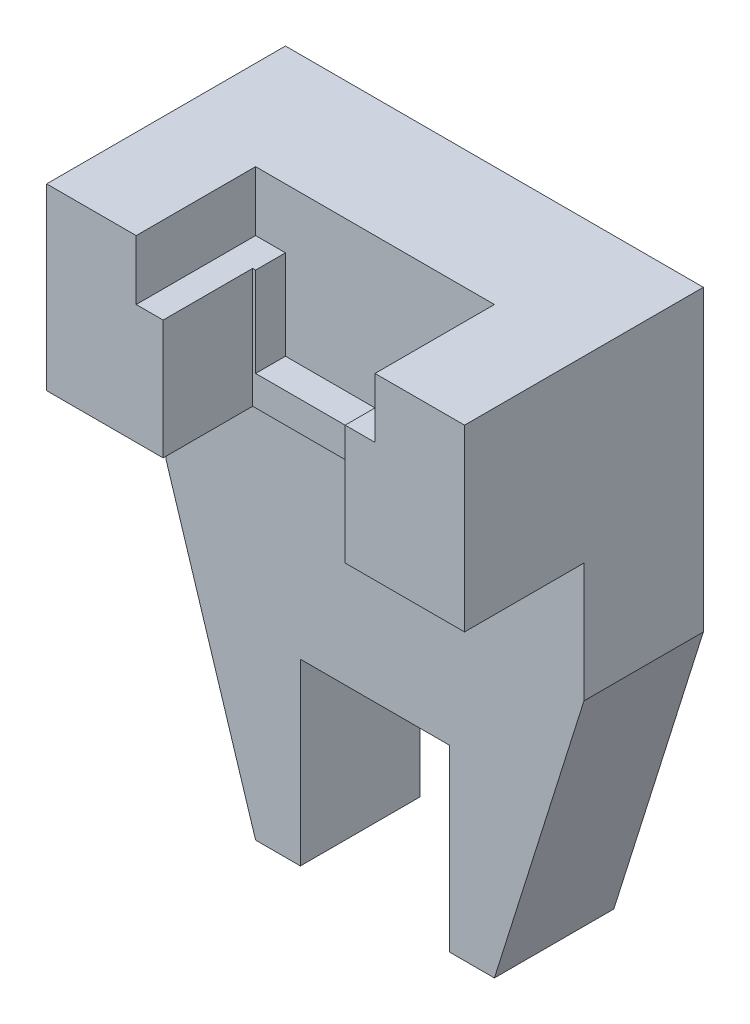
from build123d import *

# Parameters (mm, degrees)
BOSS_EXTRUDE1_DEPTH = 20
SKETCH2_W           = 15
SKETCH2_H           = 10
BOSS_EXTRUDE3_DEPTH = 40
BOSS_EXTRUDE5_DEPTH = 40
SKETCH6_W           = 30
SKETCH6_H           = 15
CUT_EXTRUDE2_DEPTH  = 40
SKETCH8_W           = 0.49
SKETCH8_H           = 15
CUT_EXTRUDE4_DEPTH  = 40


with BuildPart() as part:
    # Sketch1 → Boss-Extrude1 (new body)
    with BuildSketch(Plane.XY):
        Polygon((26.1619919, -97.696960071), (26.1619919, -67.696960071), (1.1619919, -67.696960071), (1.1619919, -97.696960071), (-6.3380081, -97.696960071), (-21.3380081, -50), (-21.3380081, 0), (48.6619919, 0), (48.6619919, -50), (33.6619919, -97.696960071), align=None)
    extrude(amount=BOSS_EXTRUDE1_DEPTH)

    # Sketch2 → Boss-Extrude3 (add)
    with BuildSketch(Plane.XY):
        with Locations((41.1619919, -5)):
            Rectangle(SKETCH2_W, SKETCH2_H)
        with Locations((-13.8380081, -5)):
            Rectangle(SKETCH2_W, SKETCH2_H)
    extrude(amount=BOSS_EXTRUDE3_DEPTH)

    # Sketch4 → Boss-Extrude5 (add)
    with BuildSketch(Plane.XY):
        Polygon((-21.3380081, -30), (48.6619919, -30), (48.6619919, -10), (28.6619919, -10), (28.6619919, -24.999154542), (13.6619919, -24.999154542), (-1.3380081, -24.999154542), (-1.3380081, -10), (-21.3380081, -10), align=None)
    extrude(amount=BOSS_EXTRUDE5_DEPTH)

    # Sketch6 → Cut-Extrude2 (cut)
    with BuildSketch(Plane.XZ.offset(30)):
        with Locations((13.172194731, 32.5)):
            Rectangle(SKETCH6_W, SKETCH6_H)
    extrude(amount=-CUT_EXTRUDE2_DEPTH, mode=Mode.SUBTRACT)

    # Sketch8 → Cut-Extrude4 (cut)
    with BuildSketch(Plane.XZ.offset(30)):
        with Locations((28.417194731, 32.5)):
            Rectangle(SKETCH8_W, SKETCH8_H)
    extrude(amount=-CUT_EXTRUDE4_DEPTH, mode=Mode.SUBTRACT)


solid = part.part
